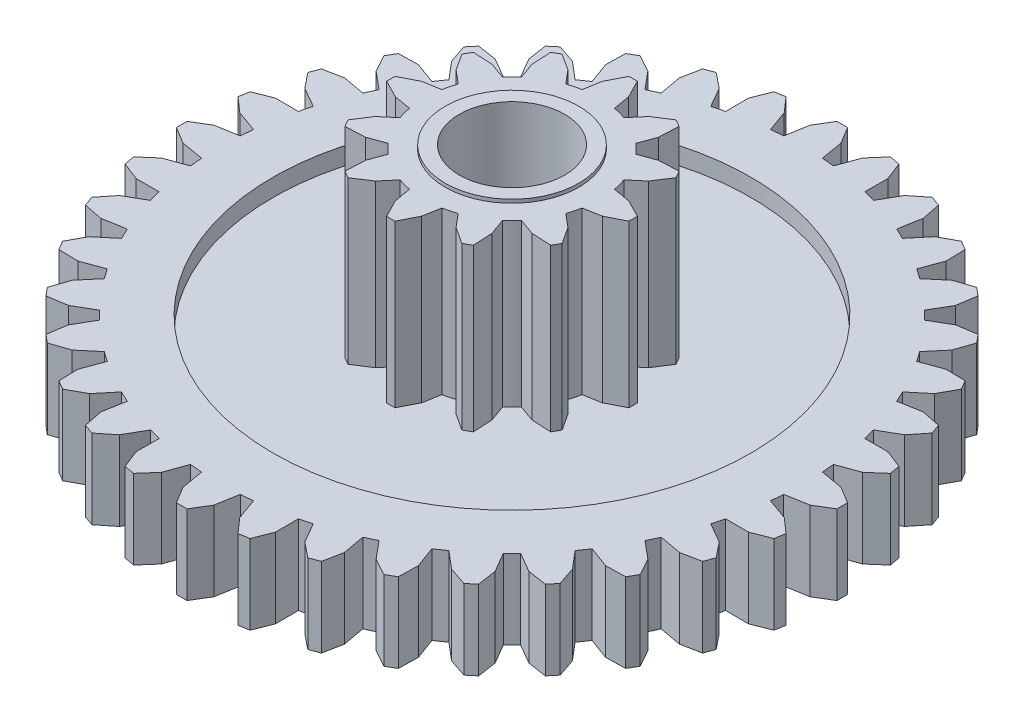
from build123d import *

# Parameters (mm, degrees)
SKETCH1_R           = 8.3
BOSS_EXTRUDE1_DEPTH = 0.63
SKETCH4_R           = 8.3
SKETCH4_R_2         = 6.8
BOSS_EXTRUDE2_DEPTH = 1.13
SKETCH6_R           = 2.5
BOSS_EXTRUDE4_DEPTH = 4.6
BOSS_EXTRUDE5_DEPTH = 4.6
CIRPATTERN2_COUNT   = 12
SKETCH8_R           = 1.9
SKETCH8_R_2         = 1.5
BOSS_EXTRUDE6_DEPTH = 0.1
CUT_EXTRUDE1_START  = -5.86
SKETCH9_R           = 1.5
CUT_EXTRUDE1_DEPTH  = 5.86
BOSS_EXTRUDE7_START = 0.4
SKETCH10_R          = 2.5
SKETCH10_R_2        = 1.5
BOSS_EXTRUDE7_DEPTH = 0.4
BOSS_EXTRUDE8_DEPTH = 2.26
CIRPATTERN3_COUNT   = 36
BOSS_EXTRUDE9_START = 0.2
SKETCH12_R          = 7.2
SKETCH12_R_2        = 6.8
BOSS_EXTRUDE9_DEPTH = 0.2


with BuildPart() as part:
    # Sketch1 → Boss-Extrude1 (new, symmetric)
    with BuildSketch(Plane(origin=(0, 0, 0), x_dir=(1, 0, 0), z_dir=(0, 1, 0))):
        with Locations(Location((0, 0, 0), (0, 0, 270))):
            Circle(SKETCH1_R)
    extrude(amount=BOSS_EXTRUDE1_DEPTH, both=True)

    # Sketch4 → Boss-Extrude2 (add, symmetric)
    with BuildSketch(Plane(origin=(0, 0, 0), x_dir=(1, 0, 0), z_dir=(0, 1, 0))):
        with Locations(Location((0, 0, 0), (0, 0, 270))):
            Circle(SKETCH4_R)
        with Locations(Location((0, 0, 0), (0, 0, 270))):
            Circle(SKETCH4_R_2, mode=Mode.SUBTRACT)
    extrude(amount=BOSS_EXTRUDE2_DEPTH, both=True)

    # Sketch6 → Boss-Extrude4 (add)
    with BuildSketch(Plane(origin=(0, 0.63, 0), x_dir=(1, 0, 0), z_dir=(0, 1, 0))):
        with Locations(Location((0, 0, 0), (0, 0, 270))):
            Circle(SKETCH6_R)
    extrude(amount=BOSS_EXTRUDE4_DEPTH)

    # Sketch7 → Boss-Extrude5 (add)
    with BuildSketch(Plane(origin=(0, 0.63, 0), x_dir=(1, 0, 0), z_dir=(0, 1, 0))):
        Polygon((-0.462187812, 2.45690505), (0.462187812, 2.45690505), (0.375, 2.94690505), (0.119218039, 3.447939538), (-0.119218039, 3.447939538), (-0.375, 2.94690505), align=None)
    boss_extrude5 = extrude(amount=BOSS_EXTRUDE5_DEPTH)

    # CirPattern2: Boss-Extrude5 ×12 about axis
    cirpattern2_axis = Axis((0, 0, 0), (0, 1, 0))
    for i in range(1, CIRPATTERN2_COUNT):
        add(boss_extrude5.rotate(cirpattern2_axis, i * 360 / CIRPATTERN2_COUNT))

    # Sketch8 → Boss-Extrude6 (add)
    with BuildSketch(Plane(origin=(0, 5.23, 0), x_dir=(1, 0, 0), z_dir=(0, 1, 0))):
        with Locations(Location((0, 0, 0), (0, 0, 270))):
            Circle(SKETCH8_R)
        with Locations(Location((0, 0, 0), (0, 0, 270))):
            Circle(SKETCH8_R_2, mode=Mode.SUBTRACT)
    extrude(amount=BOSS_EXTRUDE6_DEPTH)

    # Sketch9 → Cut-Extrude1 (cut)
    with BuildSketch(Plane(origin=(0, 5.23, 0), x_dir=(1, 0, 0), z_dir=(0, 1, 0)).offset(CUT_EXTRUDE1_START)):
        with Locations(Location((0, 0, 0), (0, 0, 270))):
            Circle(SKETCH9_R)
    extrude(amount=CUT_EXTRUDE1_DEPTH, mode=Mode.SUBTRACT)

    # Sketch10 → Boss-Extrude7 (add)
    with BuildSketch(Plane.XZ.offset(0.63).offset(BOSS_EXTRUDE7_START)):
        with Locations(Location((0, 0, 0), (0, 0, 90))):
            Circle(SKETCH10_R)
        with Locations(Location((0, 0, 0), (0, 0, 270))):
            Circle(SKETCH10_R_2, mode=Mode.SUBTRACT)
    extrude(amount=-BOSS_EXTRUDE7_DEPTH)

    # Sketch11 → Boss-Extrude8 (add)
    with BuildSketch(Plane.XZ.offset(1.13)):
        Polygon((0.55, 8.28175706), (0.44, 8.92175706), (0.15, 9.398803115), (-0.15, 9.398803115), (-0.44, 8.92175706), (-0.55, 8.28175706), align=None)
    boss_extrude8 = extrude(amount=-BOSS_EXTRUDE8_DEPTH)

    # CirPattern3: Boss-Extrude8 ×36 about axis
    cirpattern3_axis = Axis((0, 0, 0), (0, 1, 0))
    for i in range(1, CIRPATTERN3_COUNT):
        add(boss_extrude8.rotate(cirpattern3_axis, i * 360 / CIRPATTERN3_COUNT))

    # Sketch12 → Boss-Extrude9 (add)
    with BuildSketch(Plane.XZ.offset(1.13).offset(BOSS_EXTRUDE9_START)):
        with Locations(Location((0, 0, 0), (0, 0, 90))):
            Circle(SKETCH12_R)
        with Locations(Location((0, 0, 0), (0, 0, 90))):
            Circle(SKETCH12_R_2, mode=Mode.SUBTRACT)
    extrude(amount=-BOSS_EXTRUDE9_DEPTH)


solid = part.part
